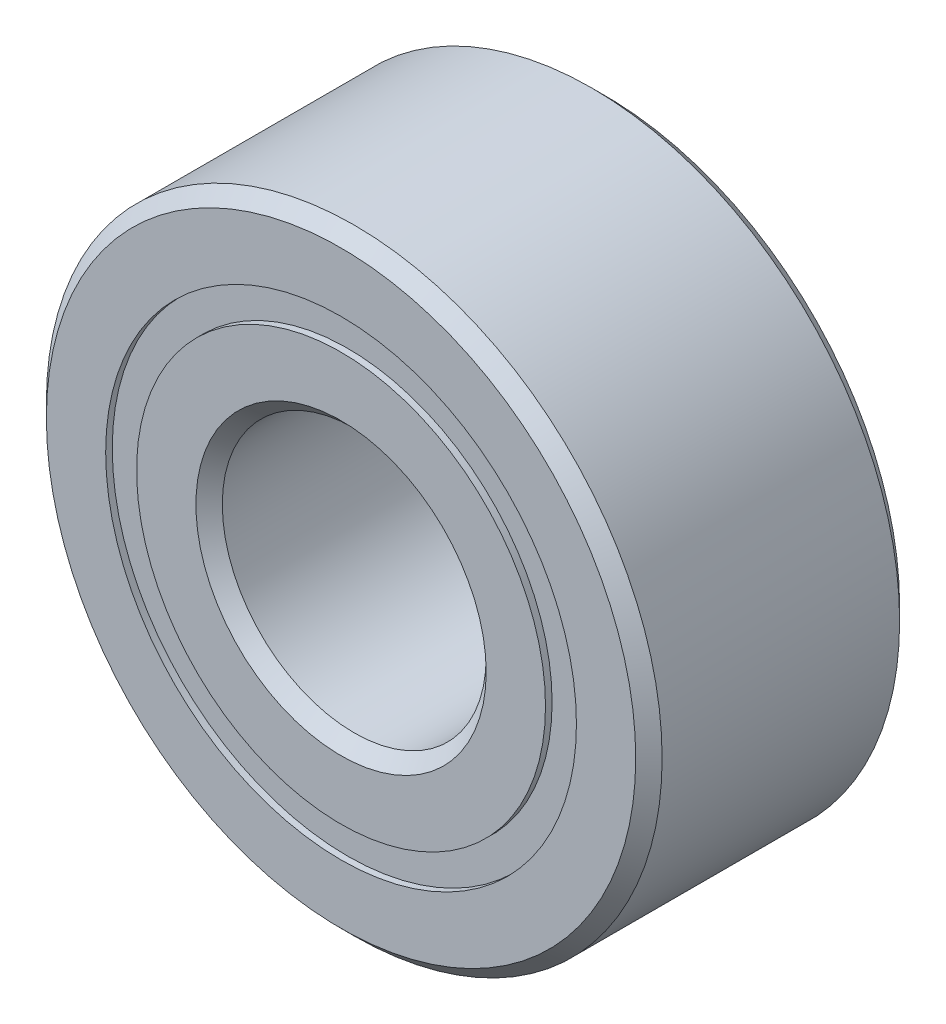
from build123d import *

# Parameters (mm, degrees)
CIRPATTERN1_COUNT = 12
SKETCH5_W         = 0.735537466
SKETCH5_H         = 0.351648352


with BuildPart() as part:
    # Sketch1 → Revolve1 (revolve)
    with BuildSketch(Plane(origin=(0, 0, 0), x_dir=(0, 0, -1), z_dir=(1, 0, 0)), mode=Mode.PRIVATE) as revolve1_sk:
        with BuildLine():
            Line((1.35, 3.5), (-1.35, 3.5))
            Line((-1.35, 3.5), (-1.5, 3.35))
            Line((-1.5, 3.35), (-1.5, 2.675824176))
            Line((-1.5, 2.675824176), (-0.666666667, 2.675824176))
            ThreePointArc((-0.666666667, 2.675824176), (0, 3.189462534), (0.666666667, 2.675824176))
            Line((0.666666667, 2.675824176), (1.5, 2.675824176))
            Line((1.5, 2.675824176), (1.5, 3.35))
            Line((1.5, 3.35), (1.35, 3.5))
        make_face()
    revolve(revolve1_sk.sketch.rotate(Axis((0, 0, 1.5), (0, 0, -1)), 90), axis=Axis((0, 0, 1.5), (0, 0, -1)))


with BuildPart() as body_2:
    # Sketch3 → Revolve3 (revolve)
    with BuildSketch(Plane(origin=(0, 0, 0), x_dir=(0, 0, -1), z_dir=(1, 0, 0)), mode=Mode.PRIVATE) as revolve3_sk:
        with BuildLine():
            Line((-1.5, 2.324175824), (-0.666666667, 2.324175824))
            ThreePointArc((-0.666666667, 2.324175824), (0, 1.810537466), (0.666666667, 2.324175824))
            Line((0.666666667, 2.324175824), (1.5, 2.324175824))
            Line((1.5, 2.324175824), (1.5, 1.65))
            Line((1.5, 1.65), (1.35, 1.5))
            Line((1.35, 1.5), (-1.35, 1.5))
            Line((-1.35, 1.5), (-1.5, 1.65))
            Line((-1.5, 1.65), (-1.5, 2.324175824))
        make_face()
    revolve(revolve3_sk.sketch.rotate(Axis((0, 0, 1.5), (0, 0, -1)), 90), axis=Axis((0, 0, 1.5), (0, 0, -1)))


with BuildPart() as body_3:
    # Sketch4 → Revolve4 (revolve)
    with BuildSketch(Plane(origin=(0, 0, 0), x_dir=(0, 0, -1), z_dir=(1, 0, 0))):
        with BuildLine():
            Line((-0.689462534, 2.5), (0.689462534, 2.5))
            ThreePointArc((0.689462534, 2.5), (0, 3.189462534), (-0.689462534, 2.5))
        make_face()
    revolve(axis=Axis((0, 2.5, 0.689462534), (0, 0, -1)))


with BuildPart() as cirpattern1_1:
    # CirPattern1: pattern copy
    add(body_3.part.rotate(Axis((0, 0, 0), (0, 0, 1)), 1 * 360 / CIRPATTERN1_COUNT))


with BuildPart() as cirpattern1_2:
    # CirPattern1: pattern copy
    add(body_3.part.rotate(Axis((0, 0, 0), (0, 0, 1)), 2 * 360 / CIRPATTERN1_COUNT))


with BuildPart() as cirpattern1_3:
    # CirPattern1: pattern copy
    add(body_3.part.rotate(Axis((0, 0, 0), (0, 0, 1)), 3 * 360 / CIRPATTERN1_COUNT))


with BuildPart() as cirpattern1_4:
    # CirPattern1: pattern copy
    add(body_3.part.rotate(Axis((0, 0, 0), (0, 0, 1)), 4 * 360 / CIRPATTERN1_COUNT))


with BuildPart() as cirpattern1_5:
    # CirPattern1: pattern copy
    add(body_3.part.rotate(Axis((0, 0, 0), (0, 0, 1)), 5 * 360 / CIRPATTERN1_COUNT))


with BuildPart() as cirpattern1_6:
    # CirPattern1: pattern copy
    add(body_3.part.rotate(Axis((0, 0, 0), (0, 0, 1)), 6 * 360 / CIRPATTERN1_COUNT))


with BuildPart() as cirpattern1_7:
    # CirPattern1: pattern copy
    add(body_3.part.rotate(Axis((0, 0, 0), (0, 0, 1)), 7 * 360 / CIRPATTERN1_COUNT))


with BuildPart() as cirpattern1_8:
    # CirPattern1: pattern copy
    add(body_3.part.rotate(Axis((0, 0, 0), (0, 0, 1)), 8 * 360 / CIRPATTERN1_COUNT))


with BuildPart() as cirpattern1_9:
    # CirPattern1: pattern copy
    add(body_3.part.rotate(Axis((0, 0, 0), (0, 0, 1)), 9 * 360 / CIRPATTERN1_COUNT))


with BuildPart() as cirpattern1_10:
    # CirPattern1: pattern copy
    add(body_3.part.rotate(Axis((0, 0, 0), (0, 0, 1)), 10 * 360 / CIRPATTERN1_COUNT))


with BuildPart() as cirpattern1_11:
    # CirPattern1: pattern copy
    add(body_3.part.rotate(Axis((0, 0, 0), (0, 0, 1)), 11 * 360 / CIRPATTERN1_COUNT))


with BuildPart() as body_15:
    # Sketch5 → Revolve5 (revolve)
    with BuildSketch(Plane(origin=(0, 0, 0), x_dir=(0, 0, -1), z_dir=(1, 0, 0)), mode=Mode.PRIVATE) as revolve5_sk:
        with Locations((-1.057231267, 2.5)):
            Rectangle(SKETCH5_W, SKETCH5_H)
        with Locations((1.057231267, 2.5)):
            Rectangle(SKETCH5_W, SKETCH5_H)
    revolve(revolve5_sk.sketch.rotate(Axis((0, 0, 1.5), (0, 0, -1)), 90), axis=Axis((0, 0, 1.5), (0, 0, -1)))


solid = Compound([part.part, body_2.part, body_3.part, cirpattern1_1.part, cirpattern1_2.part, cirpattern1_3.part, cirpattern1_4.part, cirpattern1_5.part, cirpattern1_6.part, cirpattern1_7.part, cirpattern1_8.part, cirpattern1_9.part, cirpattern1_10.part, cirpattern1_11.part, body_15.part])
